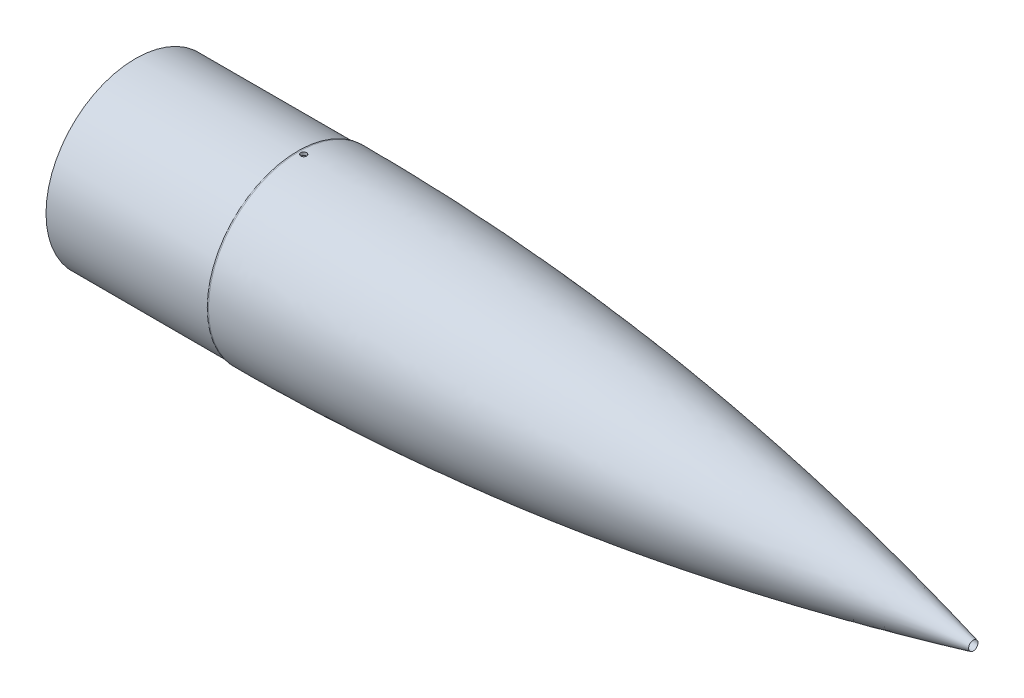
from build123d import *

# Parameters (mm, degrees)
ESQUISSE2_R                  = 76
ESQUISSE2_R_2                = 74.5
BOSS_EXTRU_1_DEPTH           = 138
ENL_V_MAT_EXTRU_1_DEPTH      = 639.853172531
ENL_V_MAT_EXTRU_1_DEPTH_BACK = 639.853172531
ESQUISSE3_R                  = 2.5
ESQUISSE4_R                  = 4
ENL_V_MAT_EXTRU_2_DEPTH      = 639.853172531


with BuildPart() as part:
    # Esquisse1 → Révolution3 (revolve)
    with BuildSketch(Plane.XY, mode=Mode.PRIVATE) as r_volution3_sk:
        with BuildLine():
            Line((-491.50407149, 74.5), (-490.50407149, 74.5))
            add(Edge.make_bspline(
                [(-490.50407149, 74.5), (-210.641164775, 74.5), (88.162014774, 0)],
                knots=[0, 0, 0, 1, 1, 1], degree=2))
            Line((88.162014774, 0), (98.49592851, 0))
            Line((98.49592851, 0), (88.766819513, 2.425739316))
            add(Edge.make_bspline(
                [(-490.50407149, 77), (-484.660460903, 77), (-472.982345417, 76.951439725), (-449.554479537, 76.660081056), (-420.185100497, 75.931692001), (-384.790988872, 74.474939228), (-337.4032762, 71.755715065), (-277.799454783, 66.900072587), (-205.68518197, 58.742907607), (-132.981039596, 48.255507982), (-71.903167077, 37.574386444), (-22.745510555, 27.864426733), (14.268518345, 19.999918851), (45.241417883, 12.959556247), (70.082061744, 7.038903949), (82.547637876, 3.976355453), (88.766819513, 2.425739316)],
                knots=[0, 0, 0, 0, 0.03125, 0.0625, 0.125, 0.1875, 0.25, 0.375, 0.5, 0.625, 0.75, 0.8125, 0.875, 0.9375, 0.96875, 1, 1, 1, 1], degree=3))
            Line((-490.50407149, 77), (-491.50407149, 77))
            Line((-491.50407149, 77), (-491.50407149, 74.5))
        make_face()
    revolve(r_volution3_sk.sketch.rotate(Axis((-218.288054544, 0, 0), (1, 0, 0)), 90), axis=Axis((-218.288054544, 0, 0), (1, 0, 0)))

    # Esquisse2 → Boss.-Extru.1 (add)
    with BuildSketch(Plane.ZY.offset(491.50407149)):
        with Locations(Location((0, 0, 0), (0, 0, 180))):
            Circle(ESQUISSE2_R)
        Circle(ESQUISSE2_R_2, mode=Mode.SUBTRACT)
    extrude(amount=BOSS_EXTRU_1_DEPTH)

    # Esquisse3 → Enlèv. mat.-Extru.1 (cut, two sides: drawn at the far end of the back side and taken through both)
    with BuildSketch(Plane(origin=(0, 0, 0), x_dir=(1, 0, 0), z_dir=(0, 1, 0)).offset(-ENL_V_MAT_EXTRU_1_DEPTH_BACK)):
        with Locations(Location((-486.50407149, 0, 0), (0, 0, 270))):
            Circle(ESQUISSE3_R)
    extrude(amount=ENL_V_MAT_EXTRU_1_DEPTH + ENL_V_MAT_EXTRU_1_DEPTH_BACK, mode=Mode.SUBTRACT)

    # Esquisse4 → Enlèv. mat.-Extru.2 (cut, through all)
    with BuildSketch(Plane(origin=(0, 0, 0), x_dir=(0, 0, -1), z_dir=(1, 0, 0))):
        with Locations(Location((0, 0, 0), (0, 0, 180))):
            Circle(ESQUISSE4_R)
    extrude(amount=ENL_V_MAT_EXTRU_2_DEPTH, mode=Mode.SUBTRACT)


solid = part.part
